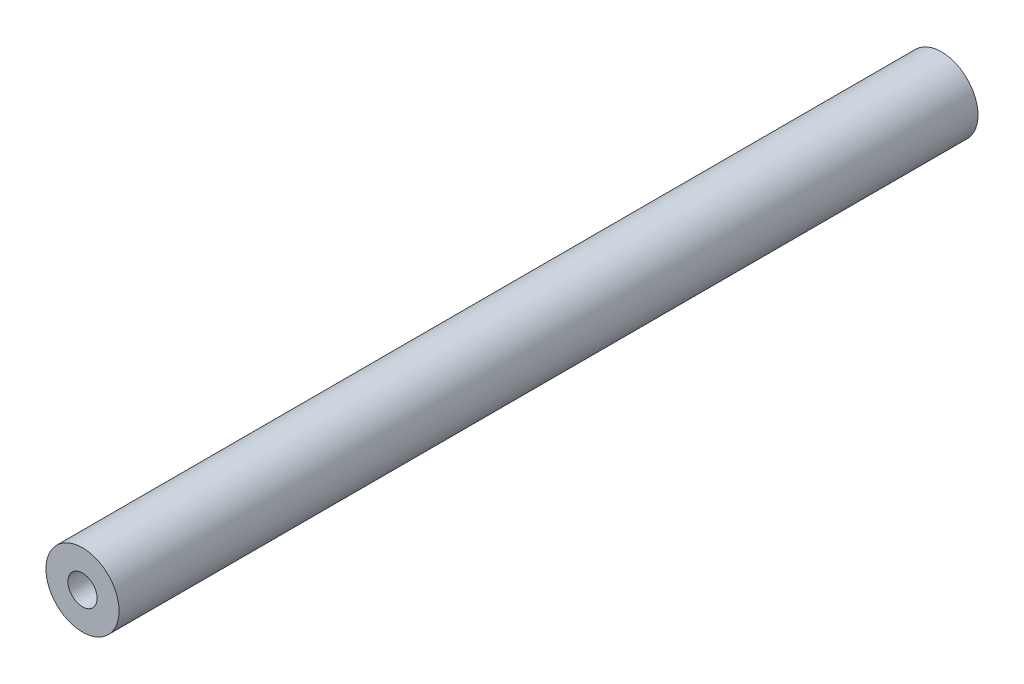
from build123d import *

# Parameters (mm, degrees)
SKETCH_1_R      = 4
SKETCH_1_R_2    = 1.6
EXTRUDE_1_DEPTH = 47


with BuildPart() as part:
    # 草图1 → 凸台-拉伸1 (new, symmetric)
    with BuildSketch(Plane.XY):
        Circle(SKETCH_1_R)
        Circle(SKETCH_1_R_2, mode=Mode.SUBTRACT)
    extrude(amount=EXTRUDE_1_DEPTH, both=True)


solid = part.part
